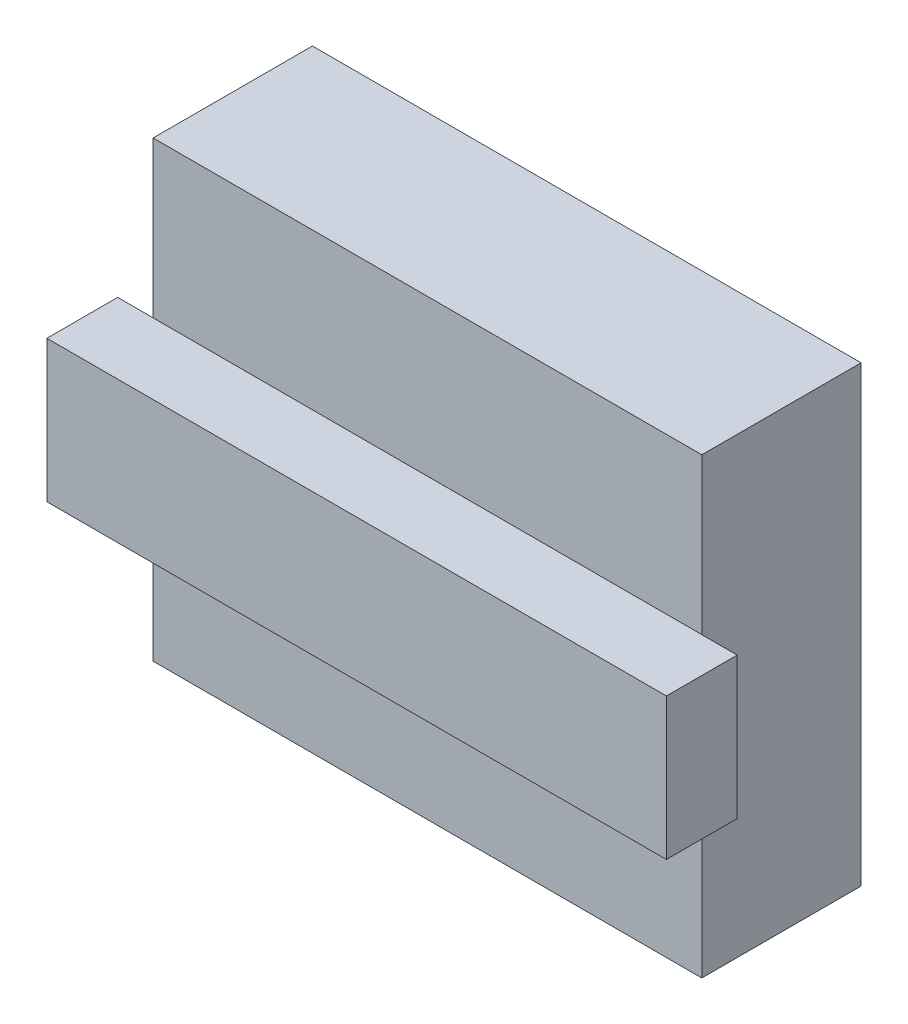
from build123d import *

# Parameters (mm, degrees)
SKETCH1_W           = 15.5
SKETCH1_H           = 12.8
BOSS_EXTRUDE1_DEPTH = 4.5
SKETCH2_R           = 1
BOSS_EXTRUDE2_DEPTH = 4
BOSS_EXTRUDE3_DEPTH = 2


with BuildPart() as part:
    # Sketch1 → Boss-Extrude1 (new body)
    with BuildSketch(Plane.XY):
        Rectangle(SKETCH1_W, SKETCH1_H)
    extrude(amount=BOSS_EXTRUDE1_DEPTH)

    # Sketch2 → Boss-Extrude2 (add)
    with BuildSketch(Plane(origin=(0, 0, 0), x_dir=(1, 0, 0), z_dir=(0, 0, -1))):
        with Locations(Location((0, 0, 0), (0, 0, 270))):
            Circle(SKETCH2_R)
    extrude(amount=BOSS_EXTRUDE2_DEPTH)

    # Sketch3 → Boss-Extrude3 (add)
    with BuildSketch(Plane.XY.offset(4.5)):
        Polygon((-7.75, 2), (-8.75, 2), (-8.75, -2), (-7.75, -2), (7.75, -2), (8.75, -2), (8.75, 2), (7.75, 2), align=None)
    extrude(amount=BOSS_EXTRUDE3_DEPTH)


solid = part.part
